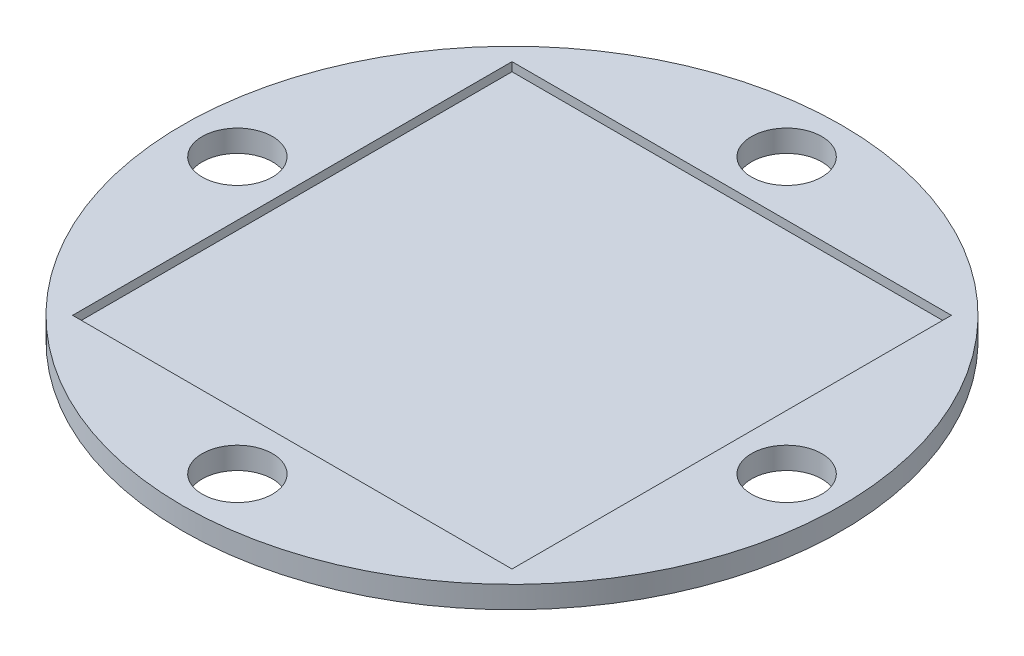
from build123d import *

# Parameters (mm, degrees)
SKETCH1_R           = 75
SKETCH1_W           = 100
SKETCH1_H           = 100
BOSS_EXTRUDE1_DEPTH = 5
SKETCH3_W           = 100
SKETCH3_H           = 100
BOSS_EXTRUDE2_DEPTH = 5
SKETCH3_2_W         = 100
SKETCH3_2_H         = 100
CUT_EXTRUDE1_DEPTH  = 2
SKETCH6_R           = 8
CUT_EXTRUDE2_DEPTH  = 10


with BuildPart() as part:
    # Sketch1 → Boss-Extrude1 (new body)
    with BuildSketch(Plane(origin=(0, 0, 0), x_dir=(1, 0, 0), z_dir=(0, 1, 0))):
        Circle(SKETCH1_R)
        Rectangle(SKETCH1_W, SKETCH1_H, mode=Mode.SUBTRACT)
    extrude(amount=BOSS_EXTRUDE1_DEPTH)

    # Sketch3 → Boss-Extrude2 (add)
    with BuildSketch(Plane(origin=(0, 5, 0), x_dir=(1, 0, 0), z_dir=(0, 1, 0))):
        Rectangle(SKETCH3_W, SKETCH3_H)
    extrude(amount=-BOSS_EXTRUDE2_DEPTH)

    # Sketch3<2> → Cut-Extrude1 (cut)
    with BuildSketch(Plane(origin=(0, 5, 0), x_dir=(1, 0, 0), z_dir=(0, 1, 0))):
        Rectangle(SKETCH3_2_W, SKETCH3_2_H)
    extrude(amount=-CUT_EXTRUDE1_DEPTH, mode=Mode.SUBTRACT)

    # Sketch6 → Cut-Extrude2 (cut)
    with BuildSketch(Plane(origin=(0, 5, 0), x_dir=(1, 0, 0), z_dir=(0, 1, 0))):
        with Locations((0, 62.5)):
            Circle(SKETCH6_R)
        with Locations((62.5, 0)):
            Circle(SKETCH6_R)
        with Locations((0, -62.5)):
            Circle(SKETCH6_R)
        with Locations((-62.5, 0)):
            Circle(SKETCH6_R)
    extrude(amount=-CUT_EXTRUDE2_DEPTH, mode=Mode.SUBTRACT)


solid = part.part
